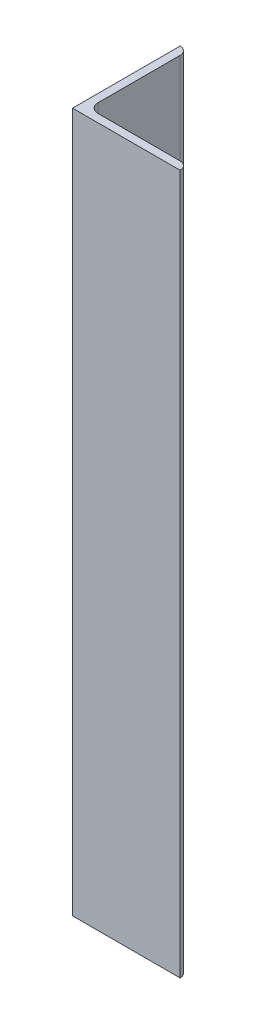
from build123d import *

# Parameters (mm, degrees)
IRON_V40X40X3_1_DEPTH = 260


with BuildPart() as part:
    # Sketch1 → Iron V40X40X3(1) (new body)
    with BuildSketch(Plane(origin=(0, 0, 0), x_dir=(1, 0, 0), z_dir=(0, 1, 0))):
        with BuildLine():
            Line((0, 0), (0, 40))
            ThreePointArc((0, 40), (2.121320344, 39.121320344), (3, 37))
            Line((3, 37), (3, 6.5))
            ThreePointArc((3, 6.5), (4.025126266, 4.025126266), (6.5, 3))
            Line((6.5, 3), (37, 3))
            ThreePointArc((37, 3), (39.121320344, 2.121320344), (40, 0))
            Line((40, 0), (0, 0))
        make_face()
    extrude(amount=IRON_V40X40X3_1_DEPTH)


solid = part.part
